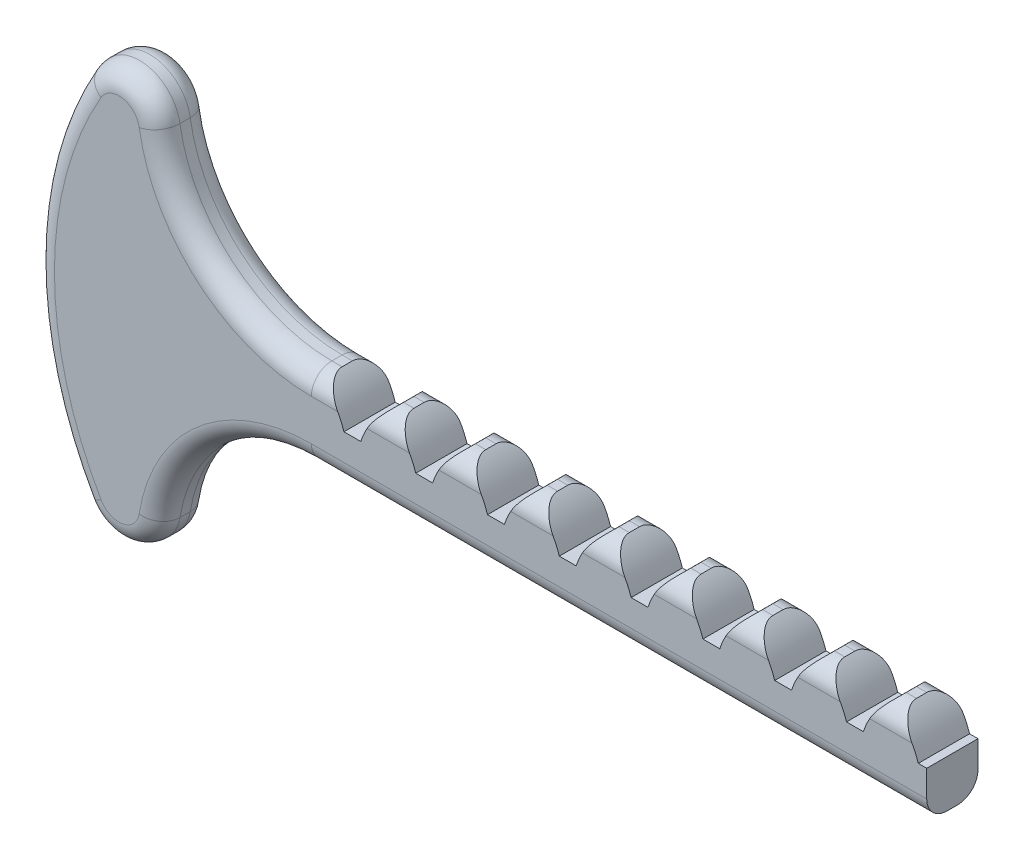
from build123d import *

# Parameters (mm, degrees)
BOSS_EXTRUDE1_DEPTH = 1.5875
FILLET1_R           = 1.27
CUT_EXTRUDE1_DEPTH  = 58.360405638
LPATTERN1_COUNT     = 16
LPATTERN1_PITCH     = 4.445
SKETCH4_R           = 7.686089714
CUT_EXTRUDE2_DEPTH  = 58.360405641


with BuildPart() as part:
    # Sketch1 → Boss-Extrude1 (new, symmetric)
    with BuildSketch(Plane.XY):
        with BuildLine():
            Line((-38.1, 0), (38.1, 0))
            Line((38.1, 0), (33.02, 5.08))
            Line((33.02, 5.08), (-38.1, 5.08))
            ThreePointArc((-38.1, 5.08), (-44.280636145, 7.357561705), (-47.505517918, 13.101052632))
            ThreePointArc((-47.505517918, 13.101052632), (-49.552624359, 15.197809), (-52.213360556, 13.97))
            ThreePointArc((-52.213360556, 13.97), (-55.276019825, 2.54), (-52.213360556, -8.89))
            ThreePointArc((-52.213360556, -8.89), (-49.552624359, -10.117809), (-47.505517918, -8.021052632))
            ThreePointArc((-47.505517918, -8.021052632), (-44.280636145, -2.277561705), (-38.1, 0))
        make_face()
    extrude(amount=BOSS_EXTRUDE1_DEPTH, both=True)

    # Fillet1
    fillet1_edges = [part.edges().sort_by_distance(p)[0] for p in [
        (-2.54, 5.08, -1.5875),
        (0, 0, -1.5875),
        (-44.280636145, -2.277561705, -1.5875),
        (-2.54, 5.08, 1.5875),
        (-44.280636145, 7.357561705, 1.5875),
        (-49.552624359, 15.197809, 1.5875),
        (-55.276019825, 2.54, 1.5875),
        (-49.552624359, -10.117809, 1.5875),
        (-44.280636145, -2.277561705, 1.5875),
        (-49.552624359, -10.117809, -1.5875),
        (0, 0, 1.5875),
        (-55.276019825, 2.54, -1.5875),
        (-49.552624359, 15.197809, -1.5875),
        (-44.280636145, 7.357561705, -1.5875),
    ]]
    fillet(fillet1_edges, radius=FILLET1_R)

    # Sketch3 → Cut-Extrude1 (cut, symmetric)
    with BuildSketch(Plane.XY):
        with BuildLine():
            Line((30.592919151, 2.921), (31.637080849, 2.921))
            ThreePointArc((31.637080849, 2.921), (32.190091062, 4.089181925), (33.02, 5.08))
            Line((33.02, 5.08), (29.21, 5.08))
            ThreePointArc((29.21, 5.08), (30.039908938, 4.089181925), (30.592919151, 2.921))
        make_face()
    cut_extrude1 = extrude(amount=CUT_EXTRUDE1_DEPTH, both=True, mode=Mode.SUBTRACT)

    # LPattern1: Cut-Extrude1 ×16
    with Locations(*[(-i * LPATTERN1_PITCH, 0, 0) for i in range(1, LPATTERN1_COUNT)]):
        add(cut_extrude1, mode=Mode.SUBTRACT)

    # Sketch4 → Cut-Extrude2 (cut, through all)
    with BuildSketch(Plane(origin=(0, 0, 0), x_dir=(0, 0, -1), z_dir=(1, 0, 0))):
        Circle(SKETCH4_R)
    extrude(amount=CUT_EXTRUDE2_DEPTH, mode=Mode.SUBTRACT)


solid = part.part
